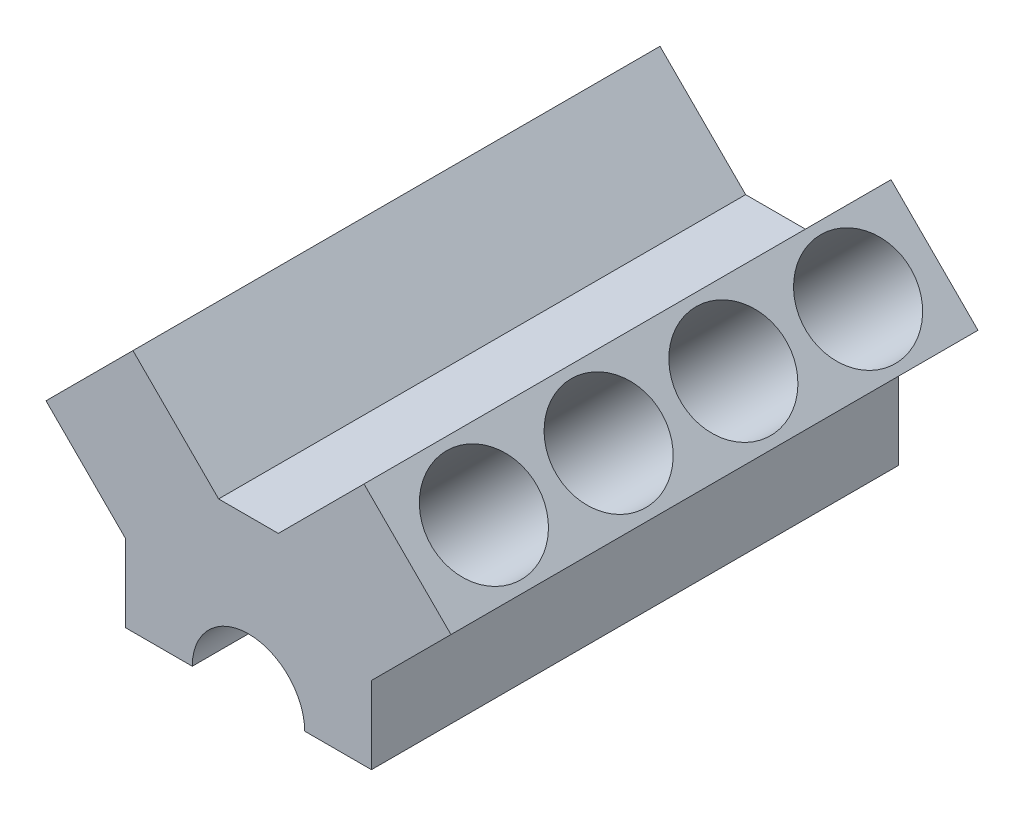
from build123d import *

# Parameters (mm, degrees)
BOSS_EXTRUDE1_DEPTH = 381
SKETCH2_R           = 38.1
CUT_EXTRUDE2_DEPTH  = 165.1
SKETCH3_R           = 38.1
CUT_EXTRUDE3_DEPTH  = 165.1


with BuildPart() as part:
    # Sketch1 → Boss-Extrude1 (new body)
    with BuildSketch(Plane.XY):
        with BuildLine():
            Line((0, 0), (48.26, 0))
            ThreePointArc((48.26, 0), (88.9, 40.64), (129.54, 0))
            Line((129.54, 0), (177.8, 0))
            Line((177.8, 0), (177.8, 55.88))
            Line((177.8, 55.88), (235.273639175, 113.353639175))
            Line((235.273639175, 113.353639175), (172.411846327, 176.215432022))
            Line((172.411846327, 176.215432022), (110.49, 114.293585695))
            Line((110.49, 114.293585695), (67.31, 114.293585695))
            Line((67.31, 114.293585695), (5.388153673, 176.215432022))
            Line((5.388153673, 176.215432022), (-57.473639175, 113.353639175))
            Line((-57.473639175, 113.353639175), (0, 55.88))
            Line((0, 55.88), (0, 0))
        make_face()
    extrude(amount=BOSS_EXTRUDE1_DEPTH)

    # Sketch2 → Cut-Extrude2 (cut)
    with BuildSketch(Plane(origin=(174.313639175, 174.313639175, 0), x_dir=(0, 0, -1), z_dir=(0.7071067811865477, 0.7071067811865475, 0))):
        with Locations(Location((-325.755, -41.757603202, 0), (0, 0, 90))):
            Circle(SKETCH2_R)
        with Locations(Location((-235.585, -41.757603202, 0), (0, 0, 90))):
            Circle(SKETCH2_R)
        with Locations(Location((-145.415, -41.757603202, 0), (0, 0, 90))):
            Circle(SKETCH2_R)
        with Locations(Location((-55.245, -41.757603202, 0), (0, 0, 90))):
            Circle(SKETCH2_R)
    extrude(amount=-CUT_EXTRUDE2_DEPTH, mode=Mode.SUBTRACT)

    # Sketch3 → Cut-Extrude3 (cut)
    with BuildSketch(Plane(origin=(-85.413639175, 85.413639175, 0), x_dir=(0, 0, 1), z_dir=(-0.7071067811865477, 0.7071067811865475, 0))):
        with Locations(Location((55.245, 83.311804159, 0), (0, 0, 270))):
            Circle(SKETCH3_R)
        with Locations(Location((145.415, 83.311804159, 0), (0, 0, 270))):
            Circle(SKETCH3_R)
        with Locations(Location((235.585, 83.311804159, 0), (0, 0, 270))):
            Circle(SKETCH3_R)
        with Locations(Location((325.755, 83.311804159, 0), (0, 0, 270))):
            Circle(SKETCH3_R)
    extrude(amount=-CUT_EXTRUDE3_DEPTH, mode=Mode.SUBTRACT)


solid = part.part
